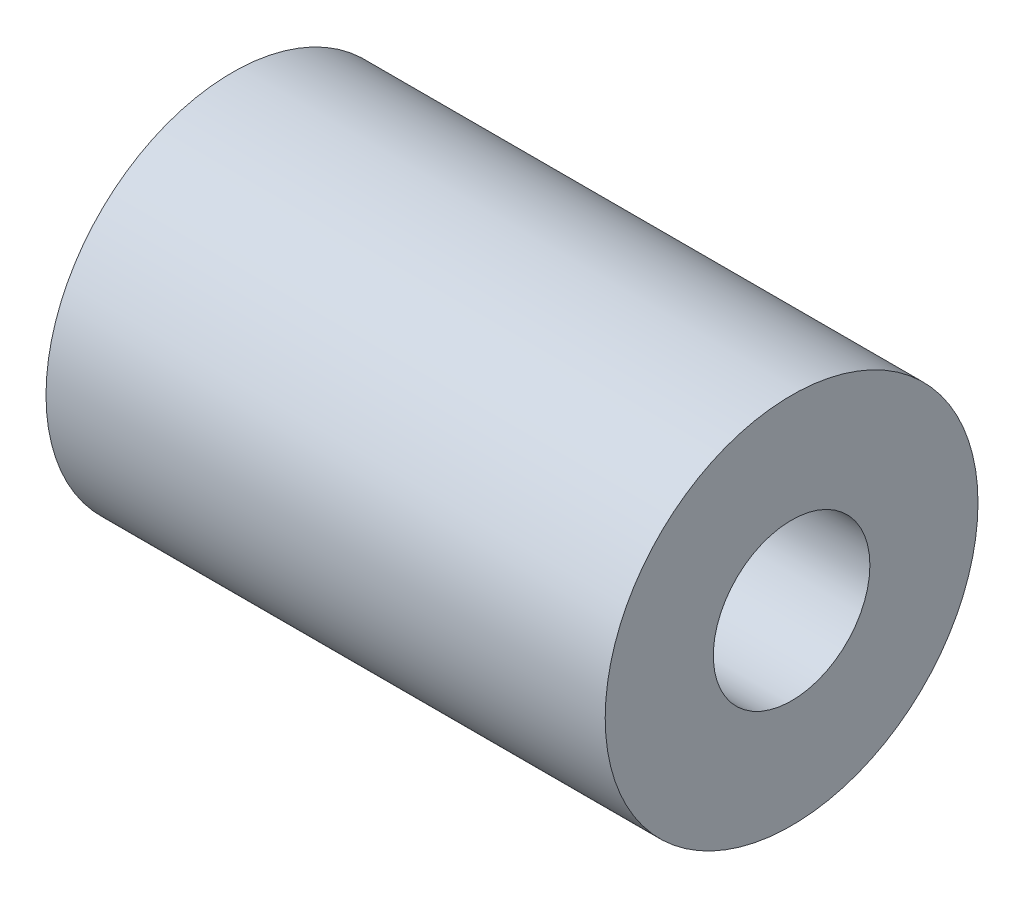
from build123d import *

# Parameters (mm, degrees)
SKIZZE1_W            = 15
SKIZZE1_H            = 5
M5_GEWINDEBOHRUNG1_D = 4.2


with BuildPart() as part:
    # Skizze1 → Rotation1 (revolve)
    with BuildSketch(Plane.XY, mode=Mode.PRIVATE) as rotation1_sk:
        with Locations((0, 2.5)):
            Rectangle(SKIZZE1_W, SKIZZE1_H)
    revolve(rotation1_sk.sketch.rotate(Axis((0, 0, 0), (1, 0, 0)), 90), axis=Axis((0, 0, 0), (1, 0, 0)))

    # M5 Gewindebohrung1 (through all)
    with Locations(Plane(origin=(7.5, 0, 0), x_dir=(0, 0, -1), z_dir=(1, 0, 0))):
        with Locations((0, 0)):
            Hole(M5_GEWINDEBOHRUNG1_D / 2)


solid = part.part
